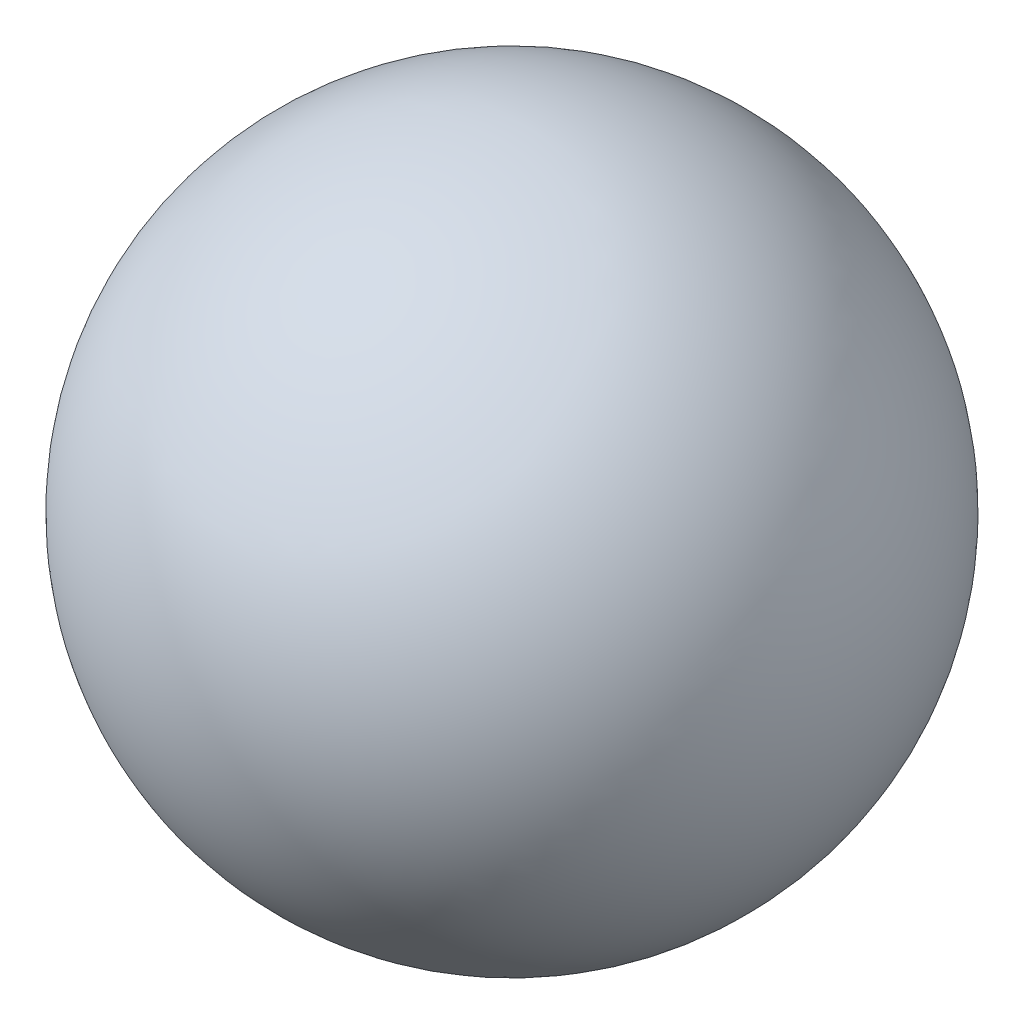
from build123d import *


with BuildPart() as part:
    # Sketch1 → Revolve5 (revolve)
    with BuildSketch(Plane(origin=(0, 0, 0), x_dir=(0, 0, -1), z_dir=(1, 0, 0))):
        with BuildLine():
            Line((-19, 0), (-18.5, 0))
            ThreePointArc((-18.5, 0), (0, 18.5), (18.5, 0))
            Line((18.5, 0), (19, 0))
            ThreePointArc((19, 0), (0, 19), (-19, 0))
        make_face()
    revolve(axis=Axis((0, 0, 33.712626631), (0, 0, -1)))


solid = part.part
